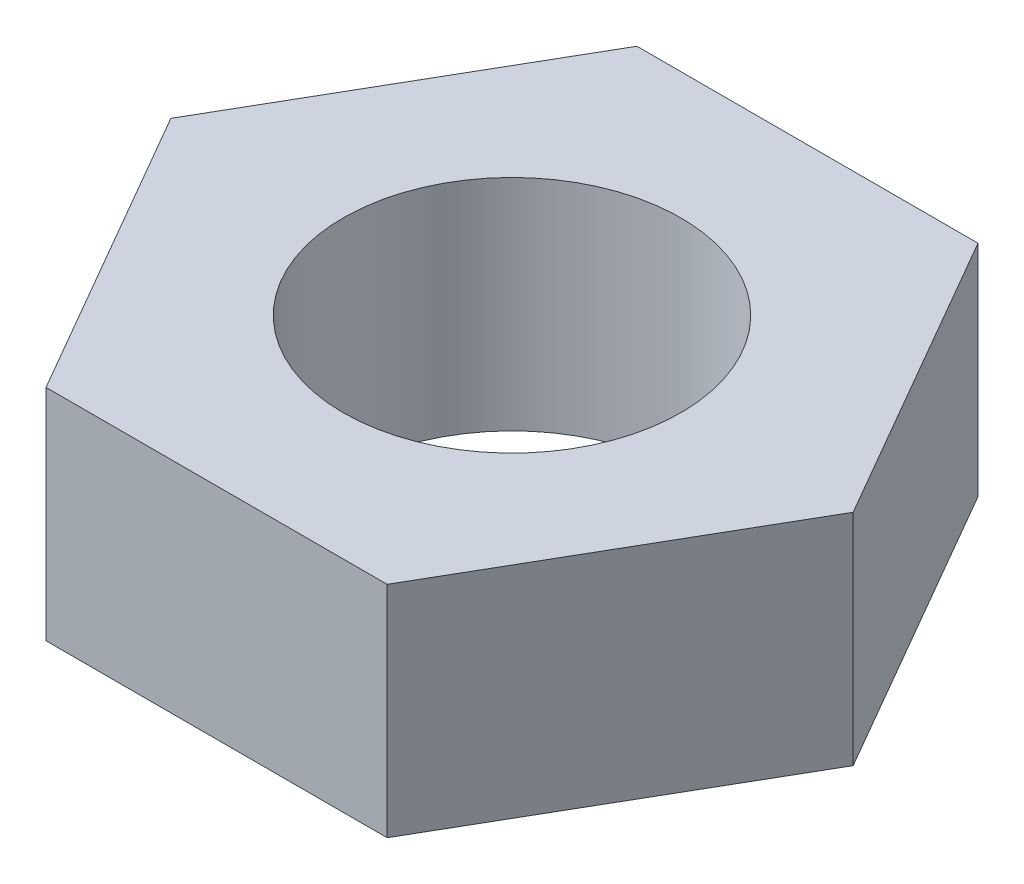
from build123d import *

# Parameters (mm, degrees)
ESQUISSE1_R        = 2
BOSS_EXTRU_1_DEPTH = 2.6


with BuildPart() as part:
    # Esquisse1 → Boss.-Extru.1 (new body)
    with BuildSketch(Plane(origin=(0, 0, 0), x_dir=(1, 0, 0), z_dir=(0, 1, 0))):
        Polygon((4.041451884, 0), (2.020725942, 3.5), (-2.020725942, 3.5), (-4.041451884, 0), (-2.020725942, -3.5), (2.020725942, -3.5), align=None)
        with Locations(Location((0, 0, 0), (0, 0, 270))):
            Circle(ESQUISSE1_R, mode=Mode.SUBTRACT)
    extrude(amount=BOSS_EXTRU_1_DEPTH)


solid = part.part
